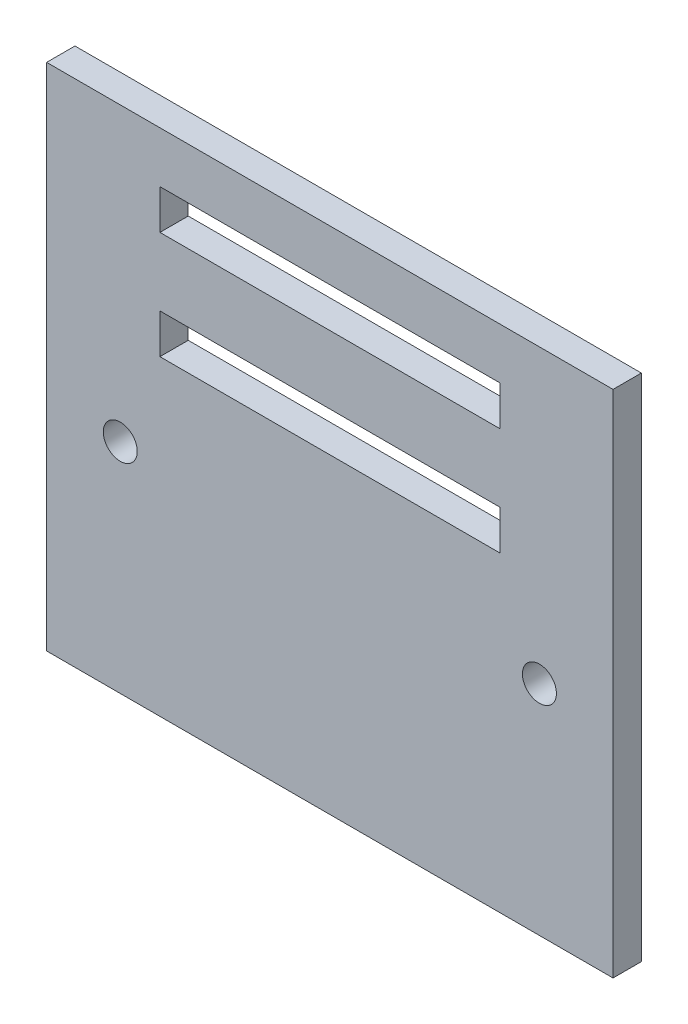
from build123d import *

# Parameters (mm, degrees)
FRAME_OUTLINE_W     = 5
FRAME_OUTLINE_H     = 4.5
FRAME_OUTLINE_R     = 0.15
FRAME_OUTLINE_W_2   = 3
FRAME_OUTLINE_H_2   = 0.35
BOSS_EXTRUDE1_DEPTH = 0.125


with BuildPart() as part:
    # frame_outline → Boss-Extrude1 (new, symmetric)
    with BuildSketch(Plane.XY):
        with Locations((2.5, 2.25)):
            Rectangle(FRAME_OUTLINE_W, FRAME_OUTLINE_H)
        with Locations((0.65, 1.925)):
            Circle(FRAME_OUTLINE_R, mode=Mode.SUBTRACT)
        with Locations((4.35, 1.925)):
            Circle(FRAME_OUTLINE_R, mode=Mode.SUBTRACT)
        with Locations((2.5, 2.925)):
            Rectangle(FRAME_OUTLINE_W_2, FRAME_OUTLINE_H_2, mode=Mode.SUBTRACT)
        with Locations((2.5, 3.875)):
            Rectangle(FRAME_OUTLINE_W_2, FRAME_OUTLINE_H_2, mode=Mode.SUBTRACT)
    extrude(amount=BOSS_EXTRUDE1_DEPTH, both=True)


solid = part.part
